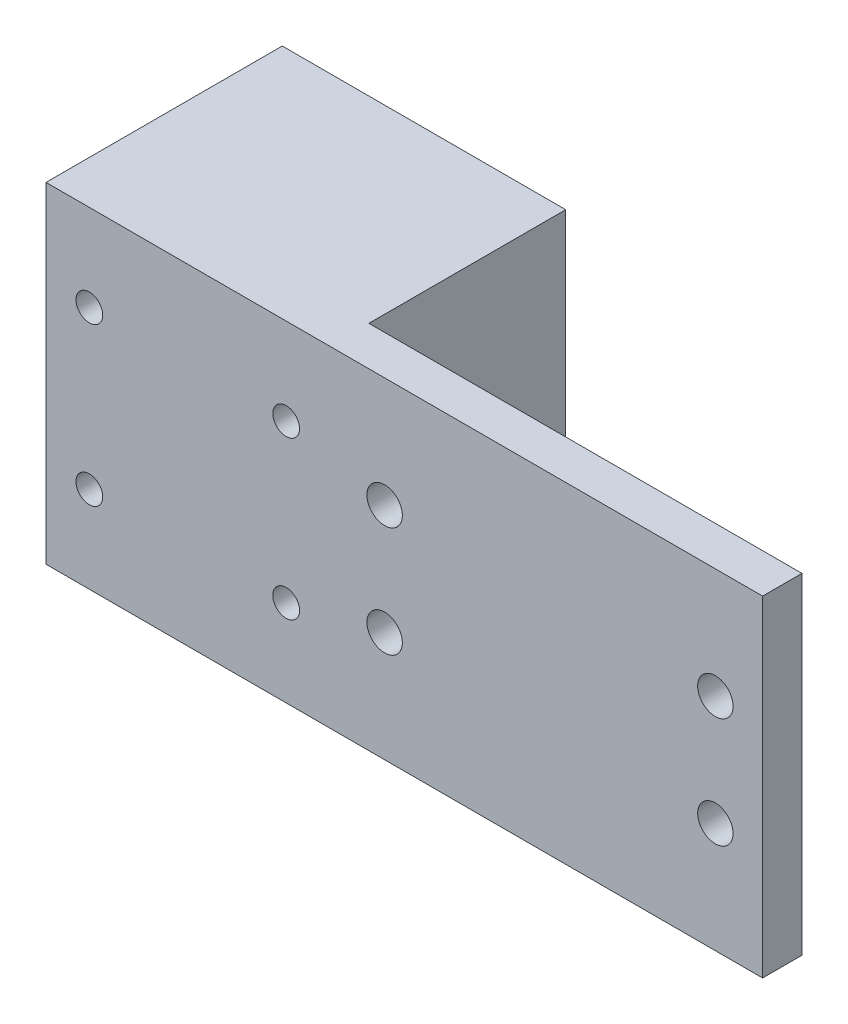
from build123d import *

# Parameters (mm, degrees)
EXTRUDE_1_DEPTH    = 42
HOLE_WIZARD_M4_1_D = 4.5
HOLE_WIZARD_M3_1_D = 3.4


with BuildPart() as part:
    # 스케치1 → 보스-돌출1 (new body)
    with BuildSketch(Plane(origin=(0, 0, 0), x_dir=(1, 0, 0), z_dir=(0, 1, 0))):
        Polygon((0, 0), (0, 30), (36, 30), (36, 5), (91, 5), (91, 0), align=None)
    extrude(amount=EXTRUDE_1_DEPTH)

    # M4 여유 구멍1 (through all)
    with Locations(Plane.XY):
        with Locations((85, 28), (85, 14), (43, 28), (43, 14)):
            Hole(HOLE_WIZARD_M4_1_D / 2)

    # M3 여유 구멍1 (through all)
    with Locations(Plane.XY):
        with Locations((5.5, 31), (5.5, 11), (30.5, 31), (30.5, 11)):
            Hole(HOLE_WIZARD_M3_1_D / 2)


solid = part.part
